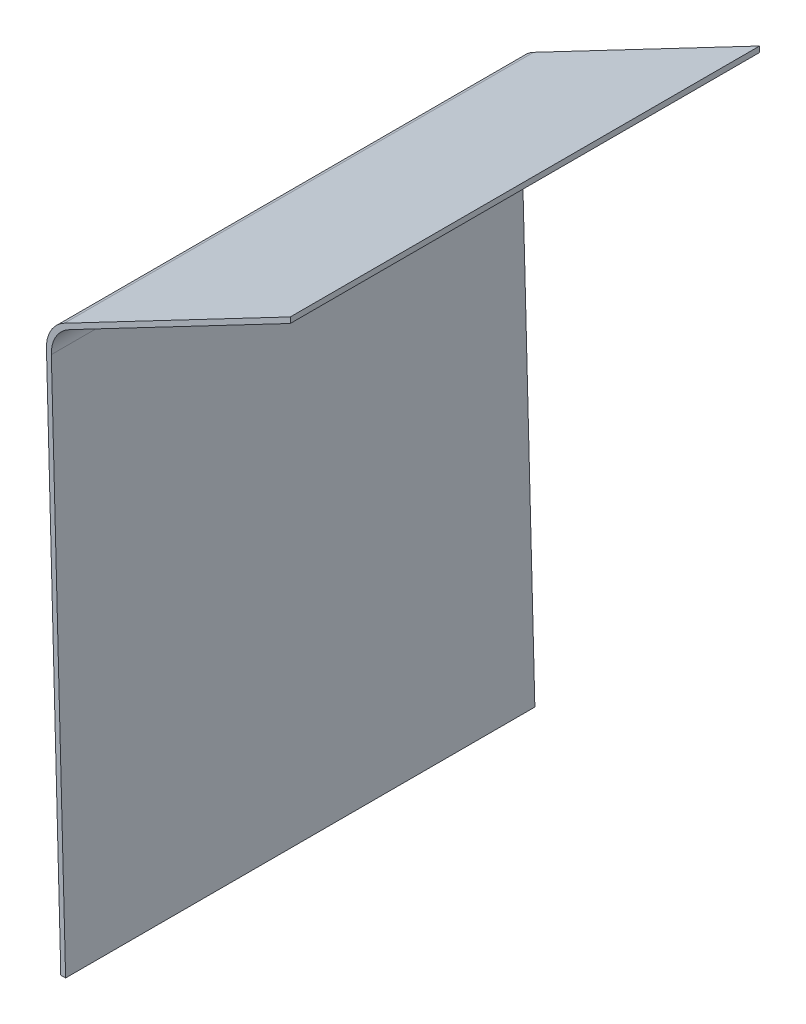
from build123d import *

# Parameters (mm, degrees)
BOSS_EXTRUDE1_DEPTH = 280


with BuildPart() as part:
    # Sketch1 → Boss-Extrude1 (new body)
    with BuildSketch(Plane.XY):
        with BuildLine():
            Line((-6.985, -1.5), (-6.985, 0))
            Line((-6.985, 0), (-6.985, 1.5))
            Line((-6.985, 1.5), (-141.773150354, -69.150147775))
            ThreePointArc((-141.773150354, -69.150147775), (-149.738239599, -76.743206199), (-152.480995182, -87.400338774))
            Line((-152.480995182, -87.400338774), (-144.05, -401.823477062))
            Line((-144.05, -401.823477062), (-144.05, -407.15))
            Line((-144.05, -407.15), (-141.05, -407.15))
            Line((-141.05, -407.15), (-149.573857666, -89.263674623))
            ThreePointArc((-149.573857666, -89.263674623), (-146.831102083, -78.606542048), (-138.866012838, -71.013483624))
            Line((-138.866012838, -71.013483624), (-6.985, -1.887132226))
            Line((-6.985, -1.887132226), (-6.985, -1.5))
        make_face()
    extrude(amount=-BOSS_EXTRUDE1_DEPTH)


solid = part.part
